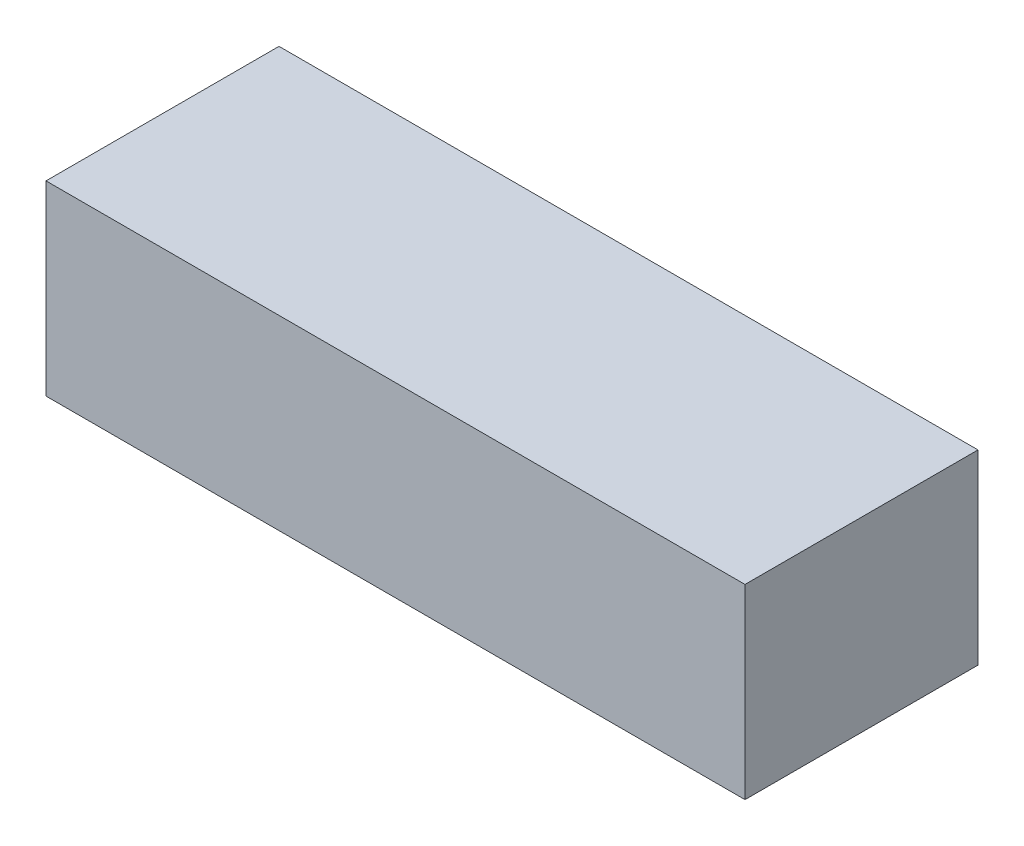
from build123d import *

# Parameters (mm, degrees)
SKETCH1_W           = 76.2
SKETCH1_H           = 25.4
BOSS_EXTRUDE1_DEPTH = 20.32


with BuildPart() as part:
    # Sketch1 → Boss-Extrude1 (new body)
    with BuildSketch(Plane(origin=(0, 0, 0), x_dir=(1, 0, 0), z_dir=(0, 1, 0))):
        Rectangle(SKETCH1_W, SKETCH1_H)
    extrude(amount=BOSS_EXTRUDE1_DEPTH)


solid = part.part
